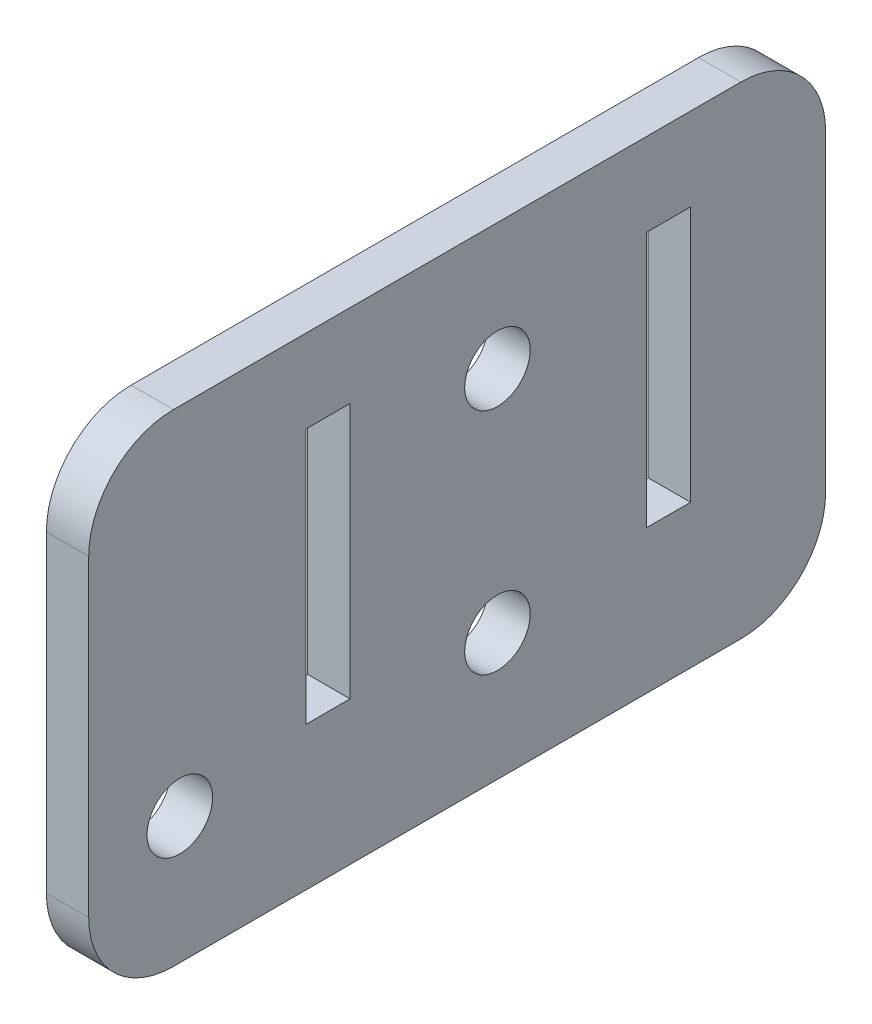
from build123d import *

# Parameters (mm, degrees)
SKETCH1_W                        = 55.245
SKETCH1_H                        = 36.15436
BOSS_EXTRUDE1_DEPTH              = 3.175
SKETCH7_W                        = 3.302
SKETCH7_H                        = 19.177
CUT_EXTRUDE1_DEPTH               = 3.175
FILLET1_R                        = 6.35
F_10_0_1935_DIAMETER_HOLE2_D     = 4.9149
F_10_0_1935_DIAMETER_HOLE2_DEPTH = 9.699415072
F_10_0_1935_DIAMETER_HOLE2_TIP   = 1.476584928


with BuildPart() as part:
    # Sketch1 → Boss-Extrude1 (new body)
    with BuildSketch(Plane(origin=(0, 0, 0), x_dir=(0, 0, -1), z_dir=(1, 0, 0))):
        with Locations((27.6225, 18.07718)):
            Rectangle(SKETCH1_W, SKETCH1_H)
    extrude(amount=BOSS_EXTRUDE1_DEPTH)

    # Sketch7 → Cut-Extrude1 (cut)
    with BuildSketch(Plane.ZY):
        with Locations((-43.469153092, 20.34286)):
            Rectangle(SKETCH7_W, SKETCH7_H)
        with Locations((-17.942153092, 20.34286)):
            Rectangle(SKETCH7_W, SKETCH7_H)
    extrude(amount=-CUT_EXTRUDE1_DEPTH, mode=Mode.SUBTRACT)

    # Fillet1
    fillet1_edges = [part.edges().sort_by_distance(p)[0] for p in [
        (1.5875, 0, 0),
        (1.5875, 36.15436, 0),
        (1.5875, 36.15436, -55.245),
        (1.5875, 0, -55.245),
    ]]
    fillet(fillet1_edges, radius=FILLET1_R)

    # #10 (0.1935) Diameter Hole2
    with Locations(Plane.ZY):
        with Locations((-30.642153092, 9.525), (-30.642153092, 26.67), (-6.829653092, 9.525)):
            Hole(F_10_0_1935_DIAMETER_HOLE2_D / 2, depth=F_10_0_1935_DIAMETER_HOLE2_DEPTH)
            with Locations((0, 0, -(F_10_0_1935_DIAMETER_HOLE2_DEPTH + F_10_0_1935_DIAMETER_HOLE2_TIP / 2))):  # 118° drill point
                Cone(0, F_10_0_1935_DIAMETER_HOLE2_D / 2, F_10_0_1935_DIAMETER_HOLE2_TIP, mode=Mode.SUBTRACT)


solid = part.part
